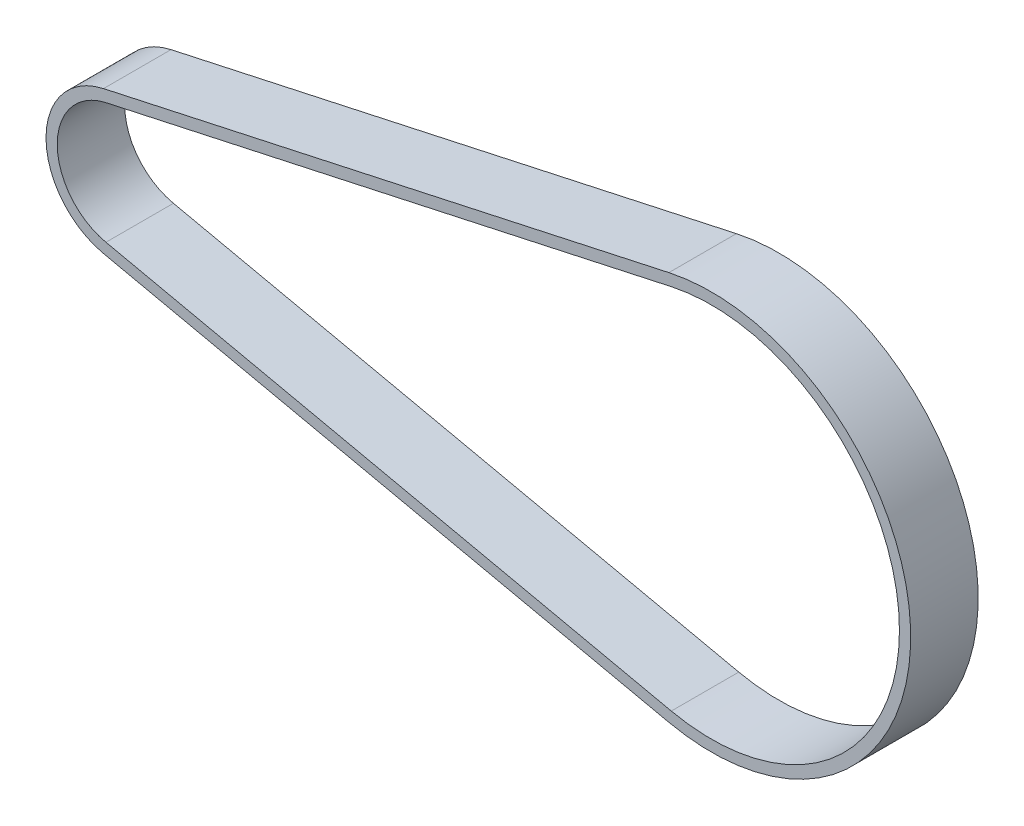
from build123d import *

# Parameters (mm, degrees)
SALIENTE_EXTRUIR1_DEPTH = 6


with BuildPart() as part:
    # Croquis1 → Saliente-Extruir1 (new body)
    with BuildSketch(Plane.XY):
        with BuildLine():
            Line((-1.385185185, 6.350689884), (48.87377208, 17.312957653))
            ThreePointArc((48.87377208, 17.312957653), (70.37, 0), (48.87377208, -17.312957653))
            Line((48.87377208, -17.312957653), (-1.385185185, -6.350689884))
            ThreePointArc((-1.385185185, -6.350689884), (-6.5, 0), (-1.385185185, 6.350689884))
        make_face()
        with BuildLine():
            Line((-1.172079772, 5.373660671), (49.086877493, 16.33592844))
            ThreePointArc((49.086877493, 16.33592844), (69.37, 0), (49.086877493, -16.33592844))
            Line((49.086877493, -16.33592844), (-1.172079772, -5.373660671))
            ThreePointArc((-1.172079772, -5.373660671), (-5.5, 0), (-1.172079772, 5.373660671))
        make_face(mode=Mode.SUBTRACT)
    extrude(amount=SALIENTE_EXTRUIR1_DEPTH)


solid = part.part
